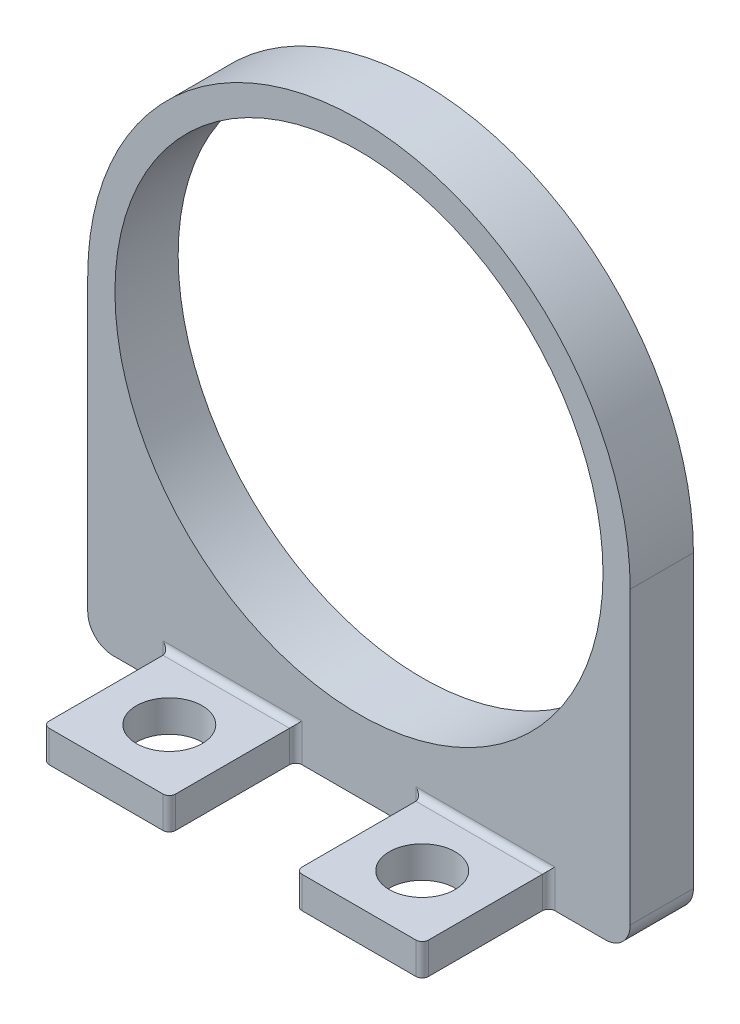
from build123d import *

# Parameters (mm, degrees)
SKETCH1_R           = 24.511
BOSS_EXTRUDE1_DEPTH = 6.35
SKETCH6_W           = 12.7
SKETCH6_H           = 19.05
BOSS_EXTRUDE3_DEPTH = 3.175
SKETCH7_R           = 3.302
CUT_EXTRUDE5_DEPTH  = 65.96524836
FILLET2_R           = 0.635
FILLET3_R           = 2.54


with BuildPart() as part:
    # Sketch1 → Boss-Extrude1 (new body)
    with BuildSketch(Plane.XY):
        with BuildLine():
            Line((-27.2415, 0), (-27.2415, -31.75))
            Line((-27.2415, -31.75), (27.2415, -31.75))
            Line((27.2415, -31.75), (27.2415, 0))
            ThreePointArc((27.2415, 0), (0, 27.2415), (-27.2415, 0))
        make_face()
        Circle(SKETCH1_R, mode=Mode.SUBTRACT)
    extrude(amount=BOSS_EXTRUDE1_DEPTH)

    # Sketch6 → Boss-Extrude3 (add)
    with BuildSketch(Plane(origin=(0, -31.75, 0), x_dir=(-1, 0, 0), z_dir=(0, -1, 0))):
        with Locations((12.7, -9.525)):
            Rectangle(SKETCH6_W, SKETCH6_H)
        with Locations((-12.7, -9.525)):
            Rectangle(SKETCH6_W, SKETCH6_H)
    extrude(amount=-BOSS_EXTRUDE3_DEPTH)

    # Sketch7 → Cut-Extrude5 (cut, through all)
    with BuildSketch(Plane(origin=(0, -28.575, 0), x_dir=(1, 0, 0), z_dir=(0, 1, 0))):
        with Locations(Location((-12.7, -12.7, 0), (0, 0, 270))):
            Circle(SKETCH7_R)
        with Locations(Location((12.7, -12.7, 0), (0, 0, 270))):
            Circle(SKETCH7_R)
    extrude(amount=-CUT_EXTRUDE5_DEPTH, mode=Mode.SUBTRACT)

    # Fillet2
    fillet2_edges = [part.edges().sort_by_distance(p)[0] for p in [
        (-6.35, -30.1625, 6.35),
        (-6.35, -30.1625, 19.05),
        (-19.05, -30.1625, 6.35),
        (-19.05, -30.1625, 19.05),
        (-12.7, -28.575, 6.35),
        (12.7, -28.575, 6.35),
        (19.05, -30.1625, 6.35),
        (19.05, -30.1625, 19.05),
        (6.35, -30.1625, 6.35),
        (6.35, -30.1625, 19.05),
    ]]
    fillet(fillet2_edges, radius=FILLET2_R)

    # Fillet3
    fillet3_edges = [part.edges().sort_by_distance(p)[0] for p in [
        (27.2415, -31.75, 3.175),
        (-27.2415, -31.75, 3.175),
    ]]
    fillet(fillet3_edges, radius=FILLET3_R)


solid = part.part
